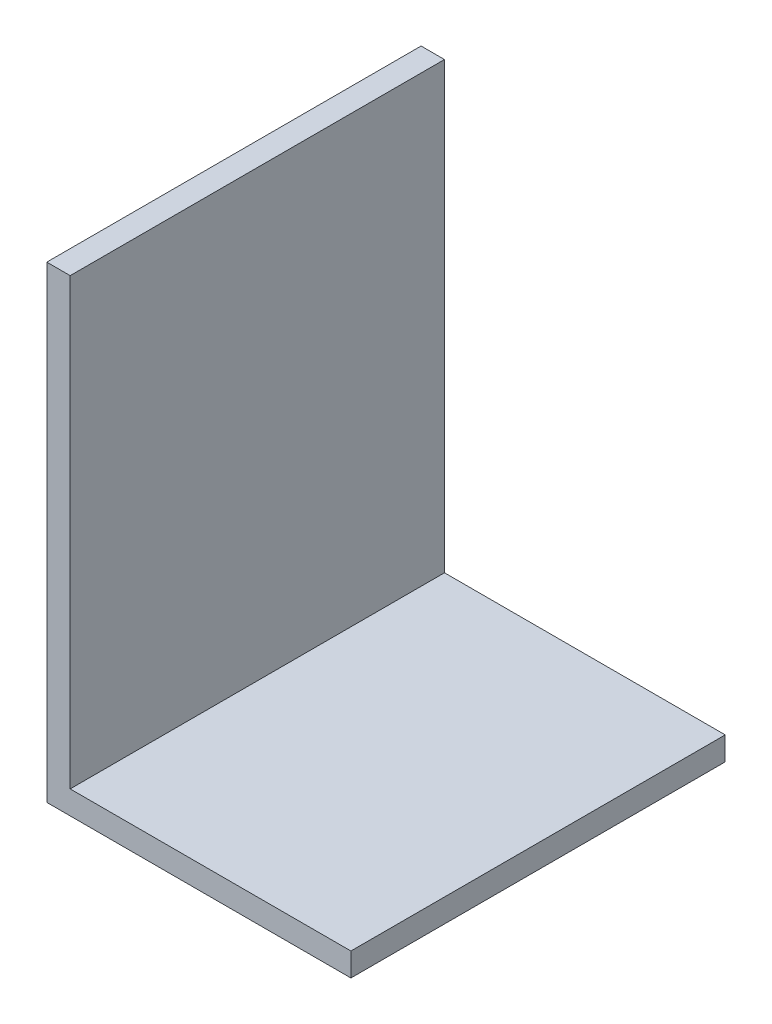
from build123d import *

# Parameters (mm, degrees)
EXTRUDE_THIN1_DEPTH = 16


with BuildPart() as part:
    # Sketch1 → Extrude-Thin1 (new body)
    with BuildSketch(Plane.XY):
        Polygon((12, 0), (0, 0), (0, 19), (-1, 19), (-1, -1), (12, -1), align=None)
    extrude(amount=EXTRUDE_THIN1_DEPTH)


solid = part.part
